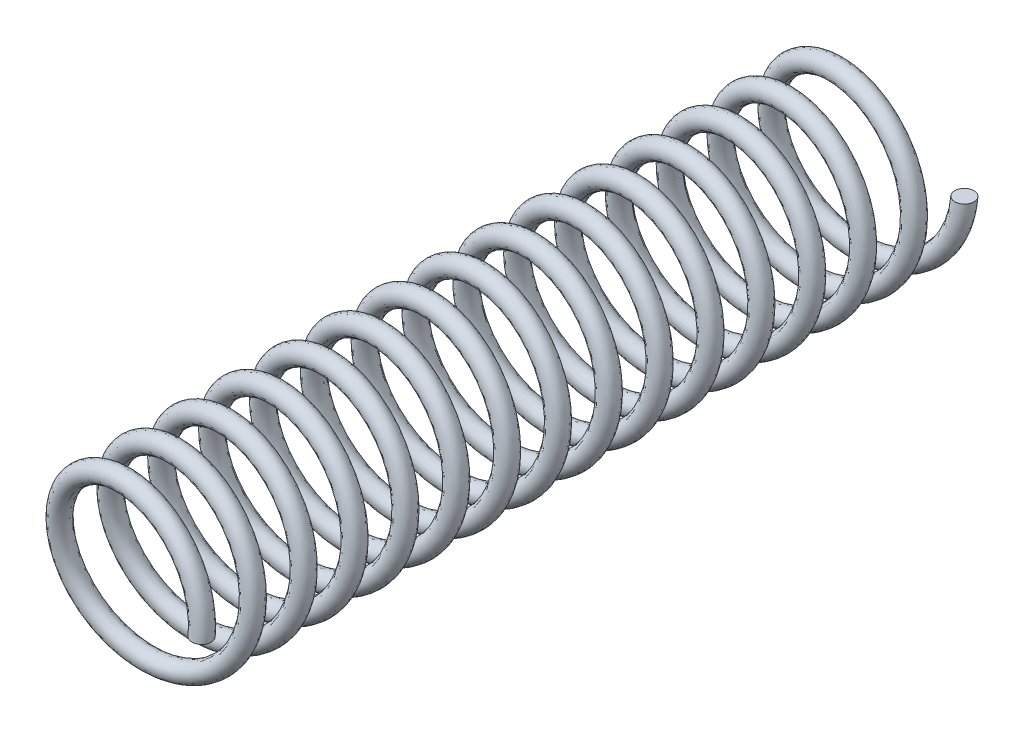
from build123d import *

# Parameters (mm, degrees)
SWEEP1_PITCH  = 2.166666667
SWEEP1_HEIGHT = 32.5
SWEEP1_RADIUS = 3.56
SKETCH4_R     = 0.41


with BuildPart() as part:
    # Sweep1: sweep along a helix
    with BuildLine() as sweep1_path:
        Helix(SWEEP1_PITCH, SWEEP1_HEIGHT, SWEEP1_RADIUS, center=(0, 0, 0), direction=(0, 0, 1), lefthand=True)
    # Sketch4 → Sweep1 (sweep)
    with BuildSketch(Plane(origin=(0, 0, 0), x_dir=(1, 0, 0), z_dir=(0, 1, 0))):
        with Locations((3.56, 0)):
            Circle(SKETCH4_R)
    sweep(path=sweep1_path.line, is_frenet=True)


solid = part.part
